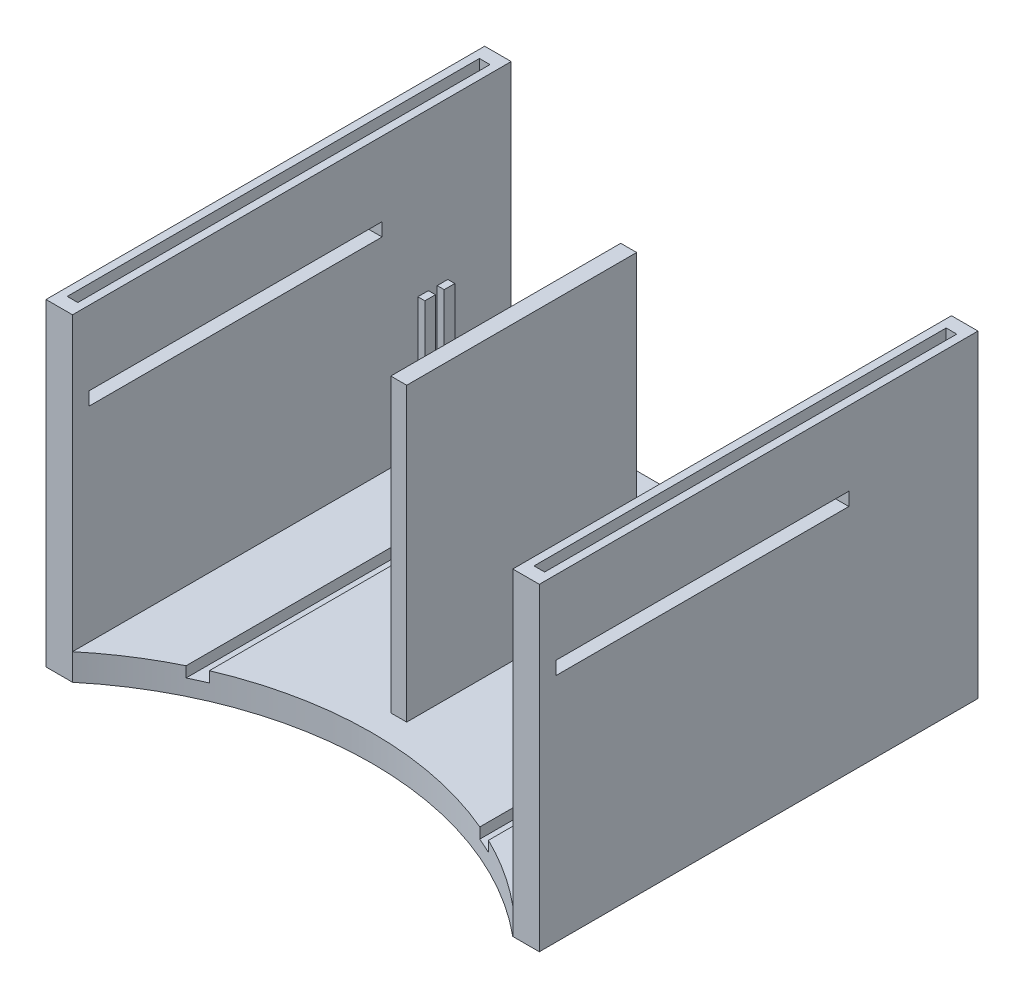
from build123d import *

# Parameters (mm, degrees)
EXTRUDE_THIN2_DEPTH     = 165.4
SKETCH11_W              = 163
SKETCH11_H              = 4
BOSS_EXTRUDE3_DEPTH     = 2.6416
CUT_EXTRUDE6_DEPTH      = 270.69086006
CUT_EXTRUDE6_DEPTH_BACK = 270.69086006
SKETCH13_W              = 110.495011338
SKETCH13_H              = 5
CUT_EXTRUDE7_DEPTH      = 273.127102656
SKETCH19_W              = 4
SKETCH19_H              = 155.4
CUT_EXTRUDE9_DEPTH      = 10
SKETCH20_W              = 4
SKETCH20_H              = 155.4
CUT_EXTRUDE10_DEPTH     = 10
SKETCH21_W              = 6
SKETCH21_H              = 86.697
BOSS_EXTRUDE4_DEPTH     = 110
CUT_EXTRUDE11_DEPTH     = 4
SKETCH23_W              = 163
SKETCH23_H              = 4
BOSS_EXTRUDE5_DEPTH     = 2.6416
SKETCH24_W              = 2.6416
SKETCH24_H              = 4
BOSS_EXTRUDE6_DEPTH     = 49.6416
SKETCH25_W              = 2.64
SKETCH25_H              = 4
BOSS_EXTRUDE7_DEPTH     = 49.6416
SKETCH26_W              = 2.64
SKETCH26_H              = 4
BOSS_EXTRUDE8_DEPTH     = 49.6416


with BuildPart() as part:
    # Sketch2 → Extrude-Thin2 (new body)
    with BuildSketch(Plane.XY):
        Polygon((0, 120), (0, 0), (186, 0), (186, 120), (176, 120), (176, 10), (10, 10), (10, 120), align=None)
    extrude(amount=EXTRUDE_THIN2_DEPTH)

    # Sketch11 → Boss-Extrude3 (add)
    with BuildSketch(Plane(origin=(0, 10, 0), x_dir=(1, 0, 0), z_dir=(0, 1, 0))):
        with Locations((93, -34.703)):
            Rectangle(SKETCH11_W, SKETCH11_H)
    extrude(amount=BOSS_EXTRUDE3_DEPTH)

    # Sketch13 → Cut-Extrude6 (cut, two sides: drawn at the far end of the back side and taken through both)
    with BuildSketch(Plane(origin=(10, 0, 0), x_dir=(0, 0, -1), z_dir=(1, 0, 0)).offset(-CUT_EXTRUDE6_DEPTH_BACK)):
        with Locations((-103.947505669, 89.551599899)):
            Rectangle(SKETCH13_W, SKETCH13_H)
    extrude(amount=CUT_EXTRUDE6_DEPTH + CUT_EXTRUDE6_DEPTH_BACK, mode=Mode.SUBTRACT)

    # Sketch14 → Cut-Extrude7 (cut, through all)
    with BuildSketch(Plane(origin=(0, 10, 0), x_dir=(1, 0, 0), z_dir=(0, 1, 0))):
        with BuildLine():
            Line((176, -165.4), (10, -165.4))
            ThreePointArc((10, -165.4), (93, -135.4), (176, -165.4))
        make_face()
    extrude(amount=-CUT_EXTRUDE7_DEPTH, mode=Mode.SUBTRACT)

    # Sketch19 → Cut-Extrude9 (cut)
    with BuildSketch(Plane(origin=(0, 120, 0), x_dir=(1, 0, 0), z_dir=(0, 1, 0))):
        with Locations((5, -82.7)):
            Rectangle(SKETCH19_W, SKETCH19_H)
    extrude(amount=-CUT_EXTRUDE9_DEPTH, mode=Mode.SUBTRACT)

    # Sketch20 → Cut-Extrude10 (cut)
    with BuildSketch(Plane(origin=(0, 120, 0), x_dir=(1, 0, 0), z_dir=(0, 1, 0))):
        with Locations((181, -82.7)):
            Rectangle(SKETCH20_W, SKETCH20_H)
    extrude(amount=-CUT_EXTRUDE10_DEPTH, mode=Mode.SUBTRACT)

    # Sketch21 → Boss-Extrude4 (add, through all)
    with BuildSketch(Plane(origin=(0, 10, 0), x_dir=(1, 0, 0), z_dir=(0, 1, 0))):
        with Locations((93, -82.0515)):
            Rectangle(SKETCH21_W, SKETCH21_H)
    extrude(amount=BOSS_EXTRUDE4_DEPTH)

    # Sketch22 → Cut-Extrude11 (cut)
    with BuildSketch(Plane(origin=(0, 10, 0), x_dir=(1, 0, 0), z_dir=(0, 1, 0))):
        Polygon((36, -48.703), (36, -148.583194008), (42, -145.837577441), (42, -48.703), align=None)
        Polygon((144, -145.837577441), (150, -148.583194008), (150, -48.703), (144, -48.703), align=None)
    extrude(amount=-CUT_EXTRUDE11_DEPTH, mode=Mode.SUBTRACT)

    # Sketch23 → Boss-Extrude5 (add)
    with BuildSketch(Plane(origin=(0, 10, 0), x_dir=(1, 0, 0), z_dir=(0, 1, 0))):
        with Locations((93, -27.4)):
            Rectangle(SKETCH23_W, SKETCH23_H)
    extrude(amount=BOSS_EXTRUDE5_DEPTH)

    # Sketch24 → Boss-Extrude6 (add)
    with BuildSketch(Plane(origin=(0, 12.6416, 0), x_dir=(1, 0, 0), z_dir=(0, 1, 0))):
        with Locations((12.8208, -34.703)):
            Rectangle(SKETCH24_W, SKETCH24_H)
    extrude(amount=BOSS_EXTRUDE6_DEPTH)

    # Sketch25 → Boss-Extrude7 (add)
    with BuildSketch(Plane(origin=(0, 12.6416, 0), x_dir=(1, 0, 0), z_dir=(0, 1, 0))):
        with Locations((12.82, -27.4)):
            Rectangle(SKETCH25_W, SKETCH25_H)
    extrude(amount=BOSS_EXTRUDE7_DEPTH)

    # Sketch26 → Boss-Extrude8 (add)
    with BuildSketch(Plane(origin=(0, 12.6416, 0), x_dir=(1, 0, 0), z_dir=(0, 1, 0))):
        with Locations((173.18, -34.703)):
            Rectangle(SKETCH26_W, SKETCH26_H)
        with Locations((173.18, -27.4)):
            Rectangle(SKETCH26_W, SKETCH26_H)
    extrude(amount=BOSS_EXTRUDE8_DEPTH)


solid = part.part
